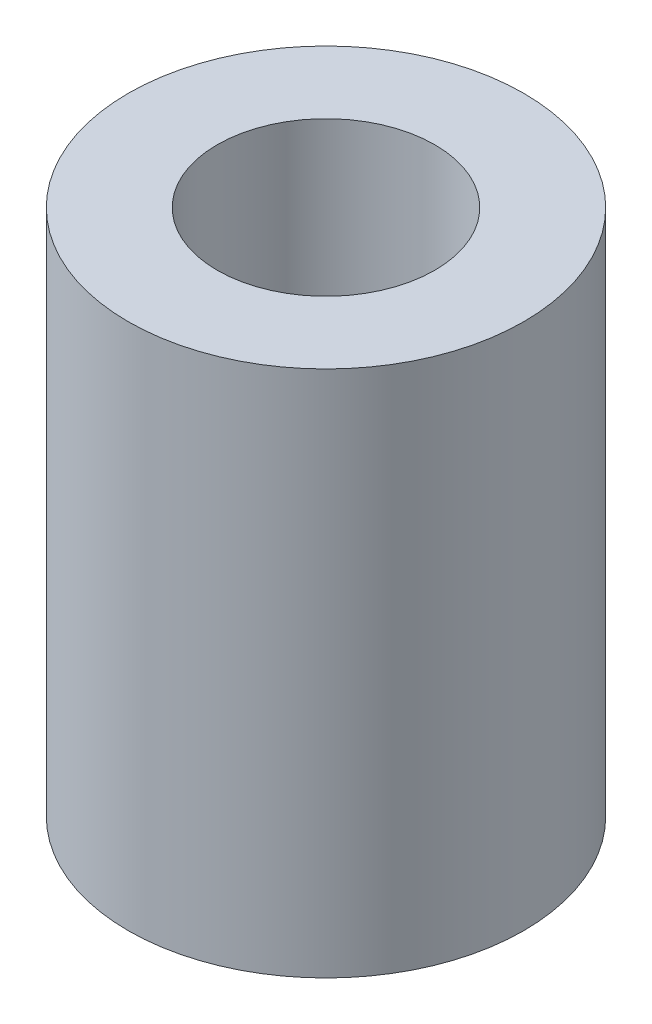
from build123d import *

# Parameters (mm, degrees)
SKETCH1_R           = 3
SKETCH1_R_2         = 1.65
BOSS_EXTRUDE1_DEPTH = 8


with BuildPart() as part:
    # Sketch1 → Boss-Extrude1 (new body)
    with BuildSketch(Plane(origin=(0, 0, 0), x_dir=(1, 0, 0), z_dir=(0, 1, 0))):
        with Locations(Location((0, 0, 0), (0, 0, 270))):
            Circle(SKETCH1_R)
        with Locations(Location((0, 0, 0), (0, 0, 270))):
            Circle(SKETCH1_R_2, mode=Mode.SUBTRACT)
    extrude(amount=BOSS_EXTRUDE1_DEPTH)


solid = part.part
